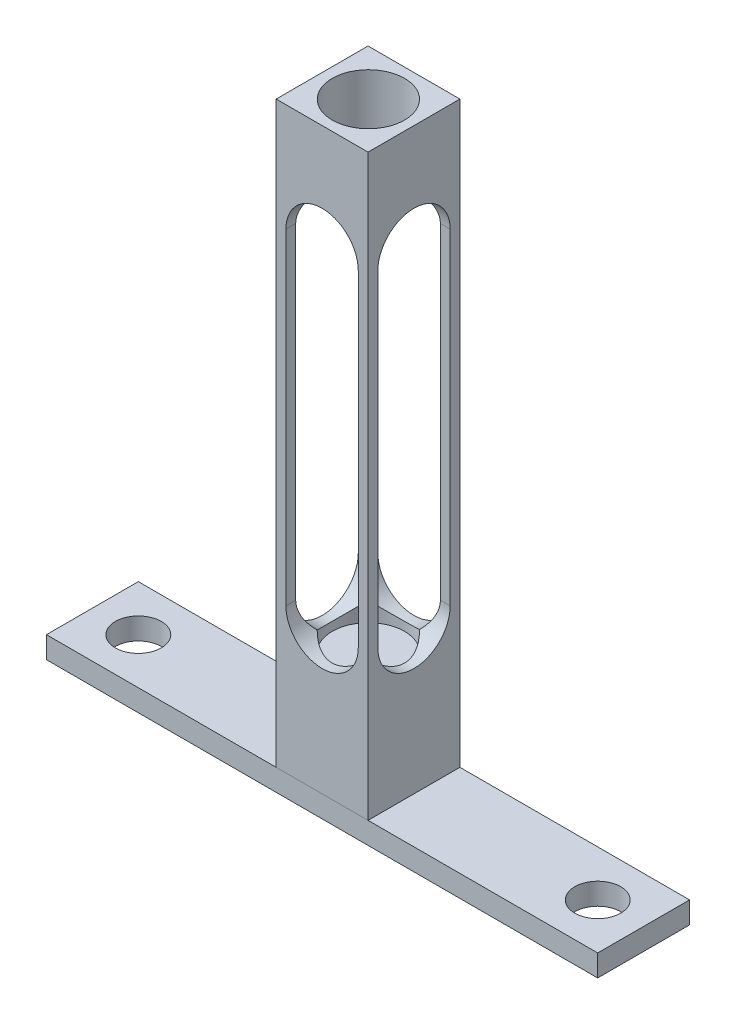
from build123d import *

# Parameters (mm, degrees)
SKETCH1_W           = 12.7
SKETCH1_H           = 80
BOSS_EXTRUDE1_DEPTH = 12.7
SKETCH4_W           = 76.2
SKETCH4_H           = 12.7
BOSS_EXTRUDE3_DEPTH = 3
CUT_EXTRUDE5_DEPTH  = 23
CUT_EXTRUDE6_DEPTH  = 23
SKETCH16_R          = 5
CUT_EXTRUDE8_DEPTH  = 66.2
SKETCH17_R          = 3.175
CUT_EXTRUDE9_DEPTH  = 3
SKETCH18_R          = 3.175
CUT_EXTRUDE10_DEPTH = 3


with BuildPart() as part:
    # Sketch1 → Boss-Extrude1 (new body)
    with BuildSketch(Plane.XY):
        with Locations((6.35, 40)):
            Rectangle(SKETCH1_W, SKETCH1_H)
    extrude(amount=BOSS_EXTRUDE1_DEPTH)

    # Sketch4 → Boss-Extrude3 (add)
    with BuildSketch(Plane(origin=(0, 0, 0), x_dir=(-1, 0, 0), z_dir=(0, -1, 0))):
        with Locations((-6.342764756, -6.3488204)):
            Rectangle(SKETCH4_W, SKETCH4_H)
    extrude(amount=BOSS_EXTRUDE3_DEPTH)

    # Sketch12 → Cut-Extrude5 (cut)
    with BuildSketch(Plane.XY.offset(12.7)):
        with BuildLine():
            Line((1.35, 20), (1.35, 65.1))
            ThreePointArc((1.35, 65.1), (6.35, 70.1), (11.35, 65.1))
            Line((11.35, 65.1), (11.35, 20))
            ThreePointArc((11.35, 20), (6.35, 15), (1.35, 20))
        make_face()
    extrude(amount=-CUT_EXTRUDE5_DEPTH, mode=Mode.SUBTRACT)

    # Sketch13 → Cut-Extrude6 (cut)
    with BuildSketch(Plane(origin=(12.7, 0, 0), x_dir=(0, 0, -1), z_dir=(1, 0, 0))):
        with BuildLine():
            Line((-11.35, 20), (-11.35, 65.1))
            ThreePointArc((-11.35, 65.1), (-6.35, 70.1), (-1.35, 65.1))
            Line((-1.35, 65.1), (-1.35, 20))
            ThreePointArc((-1.35, 20), (-6.35, 15), (-11.35, 20))
        make_face()
    extrude(amount=-CUT_EXTRUDE6_DEPTH, mode=Mode.SUBTRACT)

    # Sketch16 → Cut-Extrude8 (cut)
    with BuildSketch(Plane(origin=(0, 80, 0), x_dir=(1, 0, 0), z_dir=(0, 1, 0))):
        with Locations(Location((6.394331047, -6.34829435, 0), (0, 0, 270))):
            Circle(SKETCH16_R)
    extrude(amount=-CUT_EXTRUDE8_DEPTH, mode=Mode.SUBTRACT)

    # Sketch17 → Cut-Extrude9 (cut)
    with BuildSketch(Plane(origin=(0, 0, 0), x_dir=(1, 0, 0), z_dir=(0, 1, 0))):
        with Locations(Location((-25.407235244, -6.3488204, 0), (0, 0, 270))):
            Circle(SKETCH17_R)
    extrude(amount=-CUT_EXTRUDE9_DEPTH, mode=Mode.SUBTRACT)

    # Sketch18 → Cut-Extrude10 (cut)
    with BuildSketch(Plane(origin=(0, 0, 0), x_dir=(1, 0, 0), z_dir=(0, 1, 0))):
        with Locations(Location((38.1, -6.3488204, 0), (0, 0, 270))):
            Circle(SKETCH18_R)
    extrude(amount=-CUT_EXTRUDE10_DEPTH, mode=Mode.SUBTRACT)


solid = part.part
